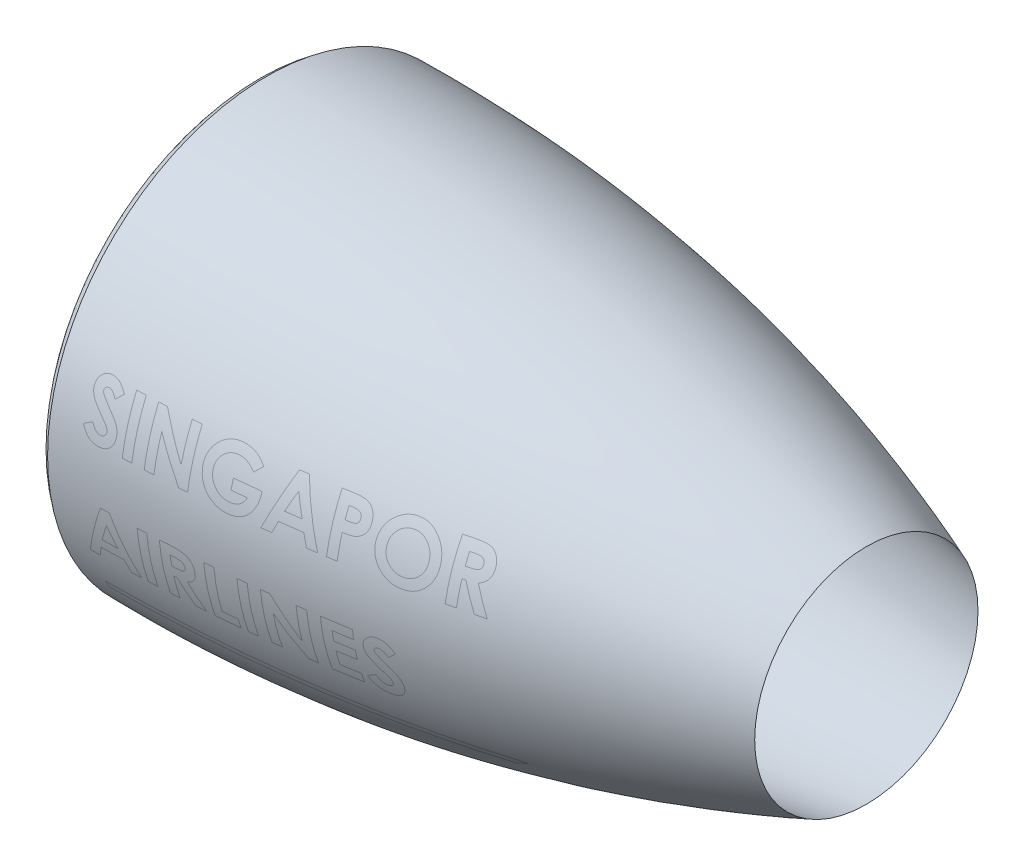
from build123d import *

# Parameters (mm, degrees)
POGRUB1_T2 = 5


with BuildPart() as body_1:
    # Powierzchnia-Obrót1: a surface, the sketch's curves turned about an axis
    with BuildLine(Plane.XY, mode=Mode.PRIVATE) as powierzchnia_obr_t1_1_path:
        Line((0, 180), (25, 180))
        Line((25, 180), (27.348940277, 190))
        Line((27.348940277, 190), (52.348940277, 190))
        Line((52.348940277, 190), (580, 108))
        add(Edge.make_bspline(
            [(580, 108), (299.963168812, 216.620332984), (0, 211.979257711)],
            knots=[0, 0, 0, 1, 1, 1], degree=2))
        add(Edge.make_bspline(
            [(0, 211.979257711), (-23.655011993, 196.988106973), (0, 180)],
            knots=[0, 0, 0, 1, 1, 1], degree=2))
    powierzchnia_obr_t1_1 = Shell.revolve(powierzchnia_obr_t1_1_path.wire(), 360, Axis((703.017512155, 0, 0), (-1, 0, 0)))
    add(Solid.thicken(powierzchnia_obr_t1_1, -POGRUB1_T2))


solid = body_1.part
